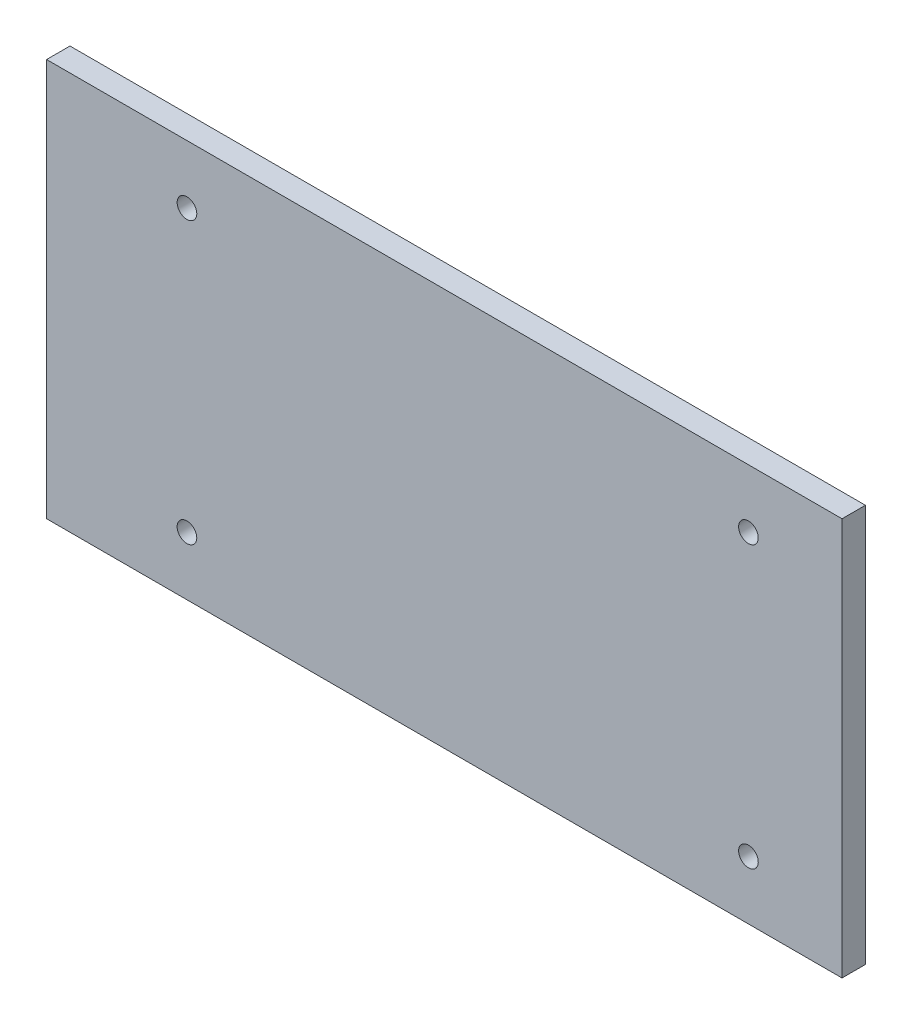
from build123d import *

# Parameters (mm, degrees)
SKETCH1_W           = 85
SKETCH1_H           = 170
SKETCH1_R           = 2.1
BOSS_EXTRUDE1_DEPTH = 5


with BuildPart() as part:
    # Sketch1 → Boss-Extrude1 (new body)
    with BuildSketch(Plane(origin=(0, 0, 0), x_dir=(0, 1, 0), z_dir=(0, 0, 1))):
        Rectangle(SKETCH1_W, SKETCH1_H)
        with Locations(Location((-30, 55, 0), (0, 0, 270))):
            Circle(SKETCH1_R, mode=Mode.SUBTRACT)
        with Locations(Location((-30, -65, 0), (0, 0, 270))):
            Circle(SKETCH1_R, mode=Mode.SUBTRACT)
        with Locations(Location((30, -65, 0), (0, 0, 90))):
            Circle(SKETCH1_R, mode=Mode.SUBTRACT)
        with Locations(Location((30, 55, 0), (0, 0, 90))):
            Circle(SKETCH1_R, mode=Mode.SUBTRACT)
    extrude(amount=BOSS_EXTRUDE1_DEPTH)


solid = part.part
